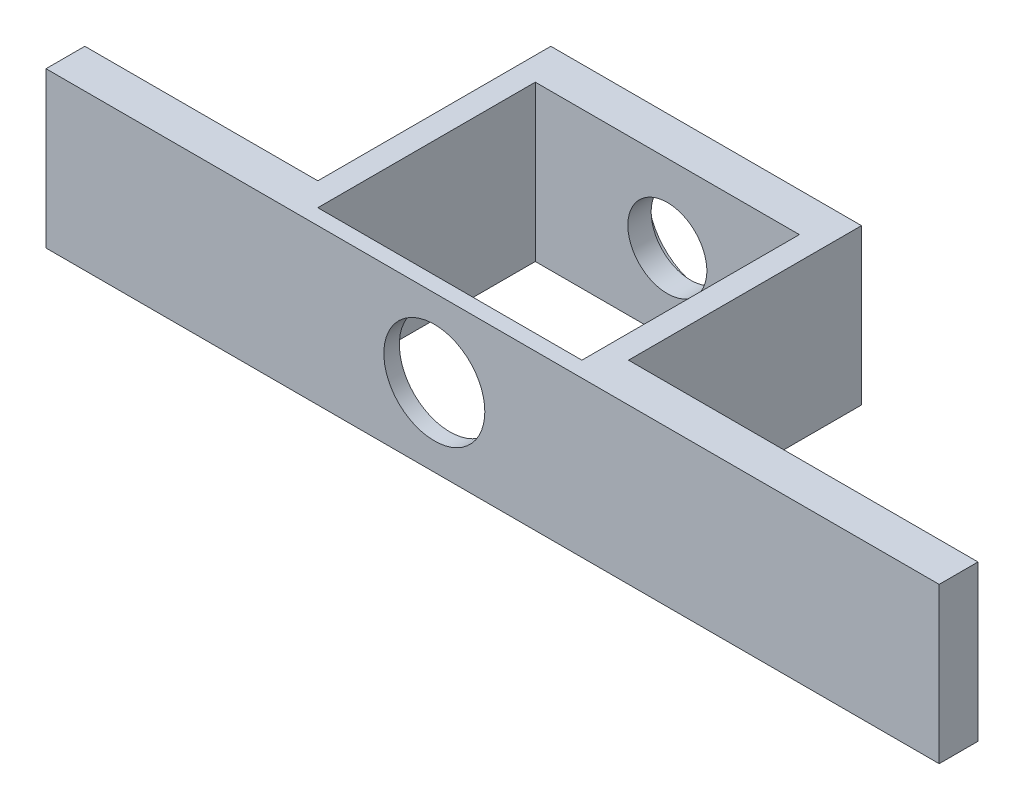
from build123d import *

# Parameters (mm, degrees)
SKETCH1_W           = 40
SKETCH1_H           = 20
BOSS_EXTRUDE1_DEPTH = 5
SKETCH2_W           = 3
SKETCH2_H           = 20
BOSS_EXTRUDE2_DEPTH = 30
SKETCH3_W           = 5
SKETCH3_H           = 20
BOSS_EXTRUDE3_DEPTH = 45
SKETCH4_W           = 5
SKETCH4_H           = 20
BOSS_EXTRUDE4_DEPTH = 30
SKETCH5_W           = 34
SKETCH5_H           = 20
BOSS_EXTRUDE5_DEPTH = 2
SKETCH6_R           = 7.5
CUT_EXTRUDE1_DEPTH  = 2
SKETCH7_R           = 5.085514488
CUT_EXTRUDE2_DEPTH  = 5
SKETCH8_R           = 6.5
CUT_EXTRUDE3_DEPTH  = 13


with BuildPart() as part:
    # Sketch1 → Boss-Extrude1 (new body)
    with BuildSketch(Plane.XY):
        Rectangle(SKETCH1_W, SKETCH1_H)
    extrude(amount=BOSS_EXTRUDE1_DEPTH)

    # Sketch2 → Boss-Extrude2 (add)
    with BuildSketch(Plane.XY.offset(5)):
        with Locations((-18.5, 0)):
            Rectangle(SKETCH2_W, SKETCH2_H)
        with Locations((18.5, 0)):
            Rectangle(SKETCH2_W, SKETCH2_H)
    extrude(amount=BOSS_EXTRUDE2_DEPTH)

    # Sketch3 → Boss-Extrude3 (add)
    with BuildSketch(Plane(origin=(20, 0, 0), x_dir=(0, 0, -1), z_dir=(1, 0, 0))):
        with Locations((-32.5, 0)):
            Rectangle(SKETCH3_W, SKETCH3_H)
    extrude(amount=BOSS_EXTRUDE3_DEPTH)

    # Sketch4 → Boss-Extrude4 (add)
    with BuildSketch(Plane.ZY.offset(20)):
        with Locations((32.5, 0)):
            Rectangle(SKETCH4_W, SKETCH4_H)
    extrude(amount=BOSS_EXTRUDE4_DEPTH)

    # Sketch5 → Boss-Extrude5 (add)
    with BuildSketch(Plane.XY.offset(35)):
        Rectangle(SKETCH5_W, SKETCH5_H)
    extrude(amount=-BOSS_EXTRUDE5_DEPTH)

    # Sketch6 → Cut-Extrude1 (cut)
    with BuildSketch(Plane(origin=(0, 0, 0), x_dir=(-1, 0, 0), z_dir=(0, 0, -1))):
        Circle(SKETCH6_R)
    extrude(amount=-CUT_EXTRUDE1_DEPTH, mode=Mode.SUBTRACT)

    # Sketch7 → Cut-Extrude2 (cut)
    with BuildSketch(Plane(origin=(0, 0, 2), x_dir=(-1, 0, 0), z_dir=(0, 0, -1))):
        Circle(SKETCH7_R)
    extrude(amount=-CUT_EXTRUDE2_DEPTH, mode=Mode.SUBTRACT)

    # Sketch8 → Cut-Extrude3 (cut)
    with BuildSketch(Plane.XY.offset(35)):
        Circle(SKETCH8_R)
    extrude(amount=-CUT_EXTRUDE3_DEPTH, mode=Mode.SUBTRACT)


solid = part.part
